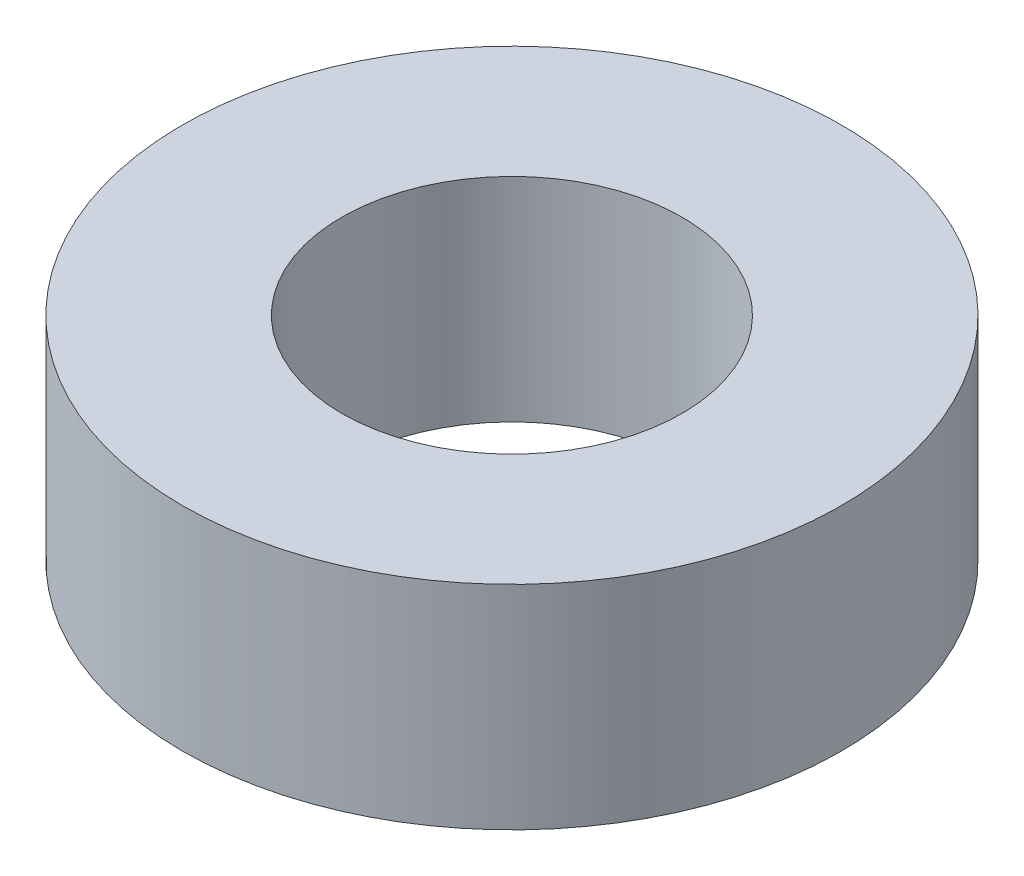
from build123d import *

# Parameters (mm, degrees)
SKETCH1_R           = 3.1
SKETCH1_R_2         = 1.6
BOSS_EXTRUDE1_DEPTH = 2


with BuildPart() as part:
    # Sketch1 → Boss-Extrude1 (new body)
    with BuildSketch(Plane(origin=(0, 0, 0), x_dir=(1, 0, 0), z_dir=(0, 1, 0))):
        with Locations(Location((0, 0, 0), (0, 0, 270))):
            Circle(SKETCH1_R)
        with Locations(Location((0, 0, 0), (0, 0, 270))):
            Circle(SKETCH1_R_2, mode=Mode.SUBTRACT)
    extrude(amount=BOSS_EXTRUDE1_DEPTH)


solid = part.part
